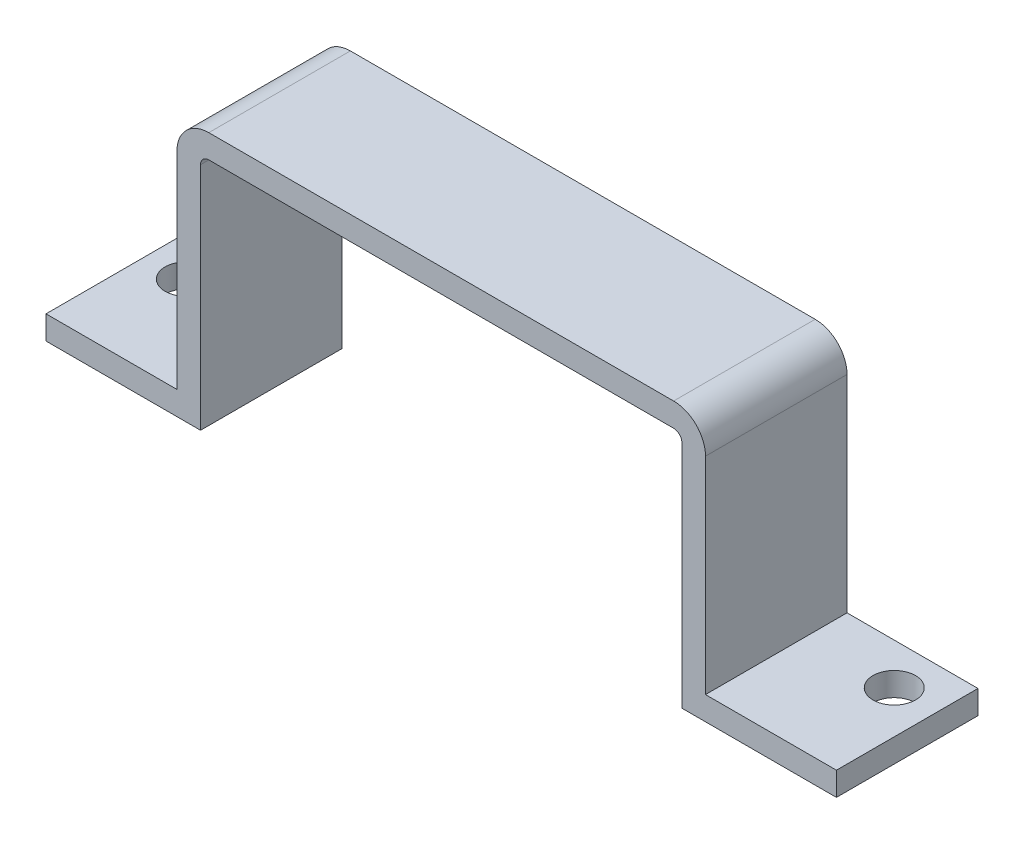
from build123d import *

# Parameters (mm, degrees)
BOSS_EXTRUDE1_DEPTH  = 12
M3_CLEARANCE_HOLE1_D = 3.6


with BuildPart() as part:
    # Sketch2 → Boss-Extrude1 (new body)
    with BuildSketch(Plane(origin=(-74.202720672, 5.306098308, 687.991999443), x_dir=(0.9999999999999999, 0, -2.239969215025861e-08), z_dir=(2.239969215025861e-08, 0, 0.9999999999999999))):
        with BuildLine():
            Line((59.700000081, 87.500000033), (59.700000081, 88.000000033))
            Line((59.700000081, 88.000000033), (59.700000142, 107.000000033))
            ThreePointArc((59.700000142, 107.000000033), (59.905025396, 107.494974779), (60.400000144, 107.70000003))
            Line((60.400000144, 107.70000003), (99.800000144, 107.699999904))
            ThreePointArc((99.800000144, 107.699999904), (100.29497489, 107.49497465), (100.500000142, 106.999999902))
            Line((100.500000142, 106.999999902), (100.500000081, 87.999999902))
            Line((100.500000081, 87.999999902), (100.500000081, 87.499999902))
            Line((100.500000081, 87.499999902), (113.600000142, 87.49999986))
            Line((113.600000142, 87.49999986), (113.600000142, 89.49999986))
            Line((113.600000142, 89.49999986), (102.500000086, 89.49999986))
            Line((102.500000086, 89.49999986), (102.500000142, 106.999999896))
            ThreePointArc((102.500000142, 106.999999896), (101.709188457, 108.909188207), (99.80000015, 109.699999904))
            Line((99.80000015, 109.699999904), (60.40000015, 109.70000003))
            ThreePointArc((60.40000015, 109.70000003), (58.490811839, 108.909188346), (57.700000142, 107.000000039))
            Line((57.700000142, 107.000000039), (57.700000142, 89.500000075))
            Line((57.700000142, 89.500000075), (46.600000142, 89.500000075))
            Line((46.600000142, 89.500000075), (46.600000142, 87.500000075))
            Line((46.600000142, 87.500000075), (59.700000081, 87.500000033))
        make_face()
    extrude(amount=BOSS_EXTRUDE1_DEPTH)

    # M3 Clearance Hole1 (through all)
    with Locations(Plane(origin=(0, 94.806098383, 0), x_dir=(1, 0, 0), z_dir=(0, 1, 0))):
        with Locations((-24.202720482, -691.491998323), (35.797279518, -691.491996979)):
            Hole(M3_CLEARANCE_HOLE1_D / 2)


solid = part.part
